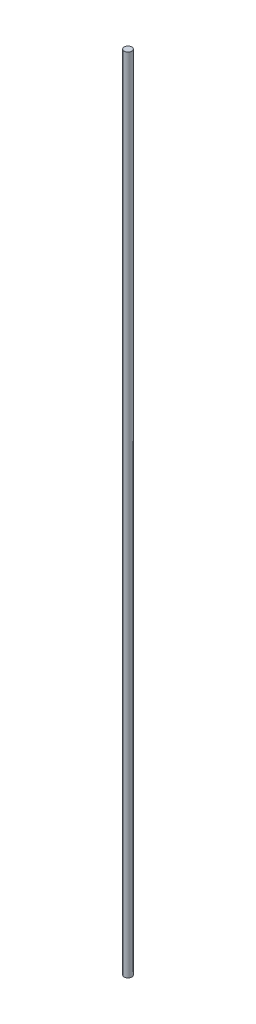
from build123d import *

# Parameters (mm, degrees)
SKETCH1_R           = 1
BOSS_EXTRUDE1_DEPTH = 213.8


with BuildPart() as part:
    # Sketch1 → Boss-Extrude1 (new body)
    with BuildSketch(Plane(origin=(0, 0, 0), x_dir=(1, 0, 0), z_dir=(0, 1, 0))):
        with Locations(Location((0, 0, 0), (0, 0, 270))):
            Circle(SKETCH1_R)
    extrude(amount=BOSS_EXTRUDE1_DEPTH)


solid = part.part
